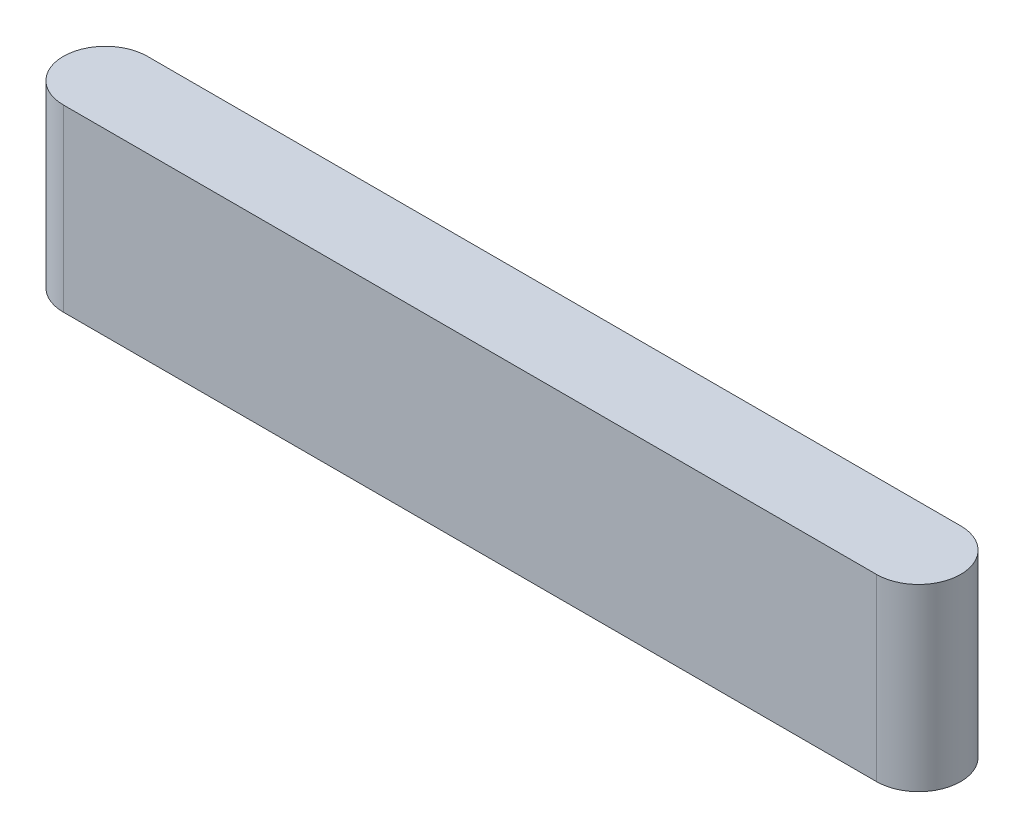
from build123d import *

# Parameters (mm, degrees)
BOSS_EXTRUDE1_DEPTH = 3.2


with BuildPart() as part:
    # Sketch1 → Boss-Extrude1 (new body)
    with BuildSketch(Plane(origin=(0, 0, 0), x_dir=(1, 0, 0), z_dir=(0, 1, 0))):
        with BuildLine():
            Line((0, 0.75), (14.5, 0.75))
            ThreePointArc((14.5, 0.75), (15.25, 0), (14.5, -0.75))
            Line((14.5, -0.75), (0, -0.75))
            ThreePointArc((0, -0.75), (-0.75, 0), (0, 0.75))
        make_face()
    extrude(amount=BOSS_EXTRUDE1_DEPTH)


solid = part.part
